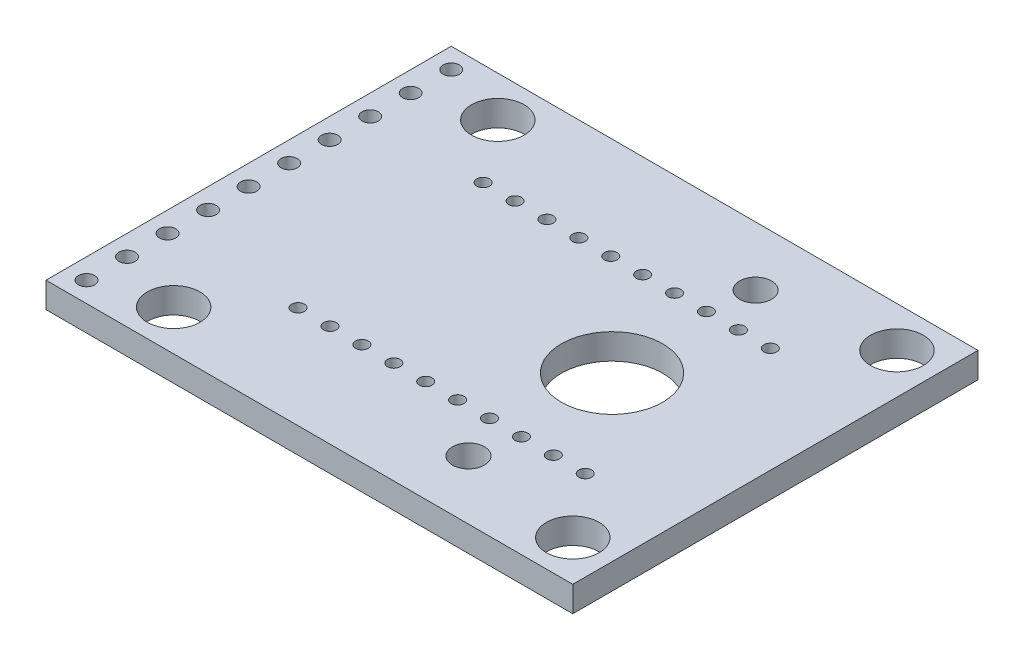
from build123d import *

# Parameters (mm, degrees)
SKETCH1_W           = 33.02
SKETCH1_H           = 25.4
SKETCH1_R           = 1.651
BOSS_EXTRUDE1_DEPTH = 1.6
SKETCH2_R           = 3.175
SKETCH2_R_2         = 0.4
SKETCH2_R_3         = 1
CUT_EXTRUDE1_DEPTH  = 42.689811705
SKETCH3_R           = 0.508
CUT_EXTRUDE2_DEPTH  = 42.689811705


with BuildPart() as part:
    # Sketch1 → Boss-Extrude1 (new body)
    with BuildSketch(Plane(origin=(0, 0, 0), x_dir=(1, 0, 0), z_dir=(0, 1, 0))):
        with Locations((16.51, 12.7)):
            Rectangle(SKETCH1_W, SKETCH1_H)
        with Locations(Location((5.461, 2.54, 0), (0, 0, 270))):
            Circle(SKETCH1_R, mode=Mode.SUBTRACT)
        with Locations(Location((30.48, 2.54, 0), (0, 0, 270))):
            Circle(SKETCH1_R, mode=Mode.SUBTRACT)
        with Locations(Location((30.48, 22.86, 0), (0, 0, 90))):
            Circle(SKETCH1_R, mode=Mode.SUBTRACT)
        with Locations(Location((5.461, 22.86, 0), (0, 0, 90))):
            Circle(SKETCH1_R, mode=Mode.SUBTRACT)
    extrude(amount=BOSS_EXTRUDE1_DEPTH)

    # Sketch2 → Cut-Extrude1 (cut, through all)
    with BuildSketch(Plane(origin=(0, 1.6, 0), x_dir=(1, 0, 0), z_dir=(0, 1, 0))):
        with Locations(Location((22.78, 12.7, 0), (0, 0, 270))):
            Circle(SKETCH2_R)
        with Locations(Location((27.4, 6.4, 0), (0, 0, 270))):
            Circle(SKETCH2_R_2)
        with Locations(Location((25.4, 6.4, 0), (0, 0, 270))):
            Circle(SKETCH2_R_2)
        with Locations(Location((23.4, 6.4, 0), (0, 0, 270))):
            Circle(SKETCH2_R_2)
        with Locations(Location((21.4, 6.4, 0), (0, 0, 270))):
            Circle(SKETCH2_R_2)
        with Locations(Location((19.4, 6.4, 0), (0, 0, 270))):
            Circle(SKETCH2_R_2)
        with Locations(Location((17.4, 6.4, 0), (0, 0, 270))):
            Circle(SKETCH2_R_2)
        with Locations(Location((15.4, 6.4, 0), (0, 0, 270))):
            Circle(SKETCH2_R_2)
        with Locations(Location((13.4, 6.4, 0), (0, 0, 270))):
            Circle(SKETCH2_R_2)
        with Locations(Location((11.4, 6.4, 0), (0, 0, 270))):
            Circle(SKETCH2_R_2)
        with Locations(Location((9.4, 6.4, 0), (0, 0, 270))):
            Circle(SKETCH2_R_2)
        with Locations(Location((26.4, 19, 0), (0, 0, 270))):
            Circle(SKETCH2_R_2)
        with Locations(Location((24.4, 19, 0), (0, 0, 270))):
            Circle(SKETCH2_R_2)
        with Locations(Location((22.4, 19, 0), (0, 0, 270))):
            Circle(SKETCH2_R_2)
        with Locations(Location((20.4, 19, 0), (0, 0, 270))):
            Circle(SKETCH2_R_2)
        with Locations(Location((18.4, 19, 0), (0, 0, 270))):
            Circle(SKETCH2_R_2)
        with Locations(Location((16.4, 19, 0), (0, 0, 270))):
            Circle(SKETCH2_R_2)
        with Locations(Location((14.4, 19, 0), (0, 0, 270))):
            Circle(SKETCH2_R_2)
        with Locations(Location((12.4, 19, 0), (0, 0, 270))):
            Circle(SKETCH2_R_2)
        with Locations(Location((10.4, 19, 0), (0, 0, 270))):
            Circle(SKETCH2_R_2)
        with Locations(Location((8.4, 19, 0), (0, 0, 270))):
            Circle(SKETCH2_R_2)
        with Locations(Location((22.78, 3.7, 0), (0, 0, 270))):
            Circle(SKETCH2_R_3)
        with Locations(Location((22.78, 21.7, 0), (0, 0, 270))):
            Circle(SKETCH2_R_3)
    extrude(amount=-CUT_EXTRUDE1_DEPTH, mode=Mode.SUBTRACT)

    # Sketch3 → Cut-Extrude2 (cut, through all)
    with BuildSketch(Plane(origin=(0, 1.6, 0), x_dir=(1, 0, 0), z_dir=(0, 1, 0))):
        with Locations(Location((1.27, 1.27, 0), (0, 0, 270))):
            Circle(SKETCH3_R)
        with Locations(Location((1.27, 3.81, 0), (0, 0, 270))):
            Circle(SKETCH3_R)
        with Locations(Location((1.27, 6.35, 0), (0, 0, 270))):
            Circle(SKETCH3_R)
        with Locations(Location((1.27, 8.89, 0), (0, 0, 270))):
            Circle(SKETCH3_R)
        with Locations(Location((1.27, 11.43, 0), (0, 0, 270))):
            Circle(SKETCH3_R)
        with Locations(Location((1.27, 13.97, 0), (0, 0, 270))):
            Circle(SKETCH3_R)
        with Locations(Location((1.27, 16.51, 0), (0, 0, 270))):
            Circle(SKETCH3_R)
        with Locations(Location((1.27, 19.05, 0), (0, 0, 270))):
            Circle(SKETCH3_R)
        with Locations(Location((1.27, 21.59, 0), (0, 0, 270))):
            Circle(SKETCH3_R)
        with Locations(Location((1.27, 24.13, 0), (0, 0, 270))):
            Circle(SKETCH3_R)
    extrude(amount=-CUT_EXTRUDE2_DEPTH, mode=Mode.SUBTRACT)


solid = part.part
